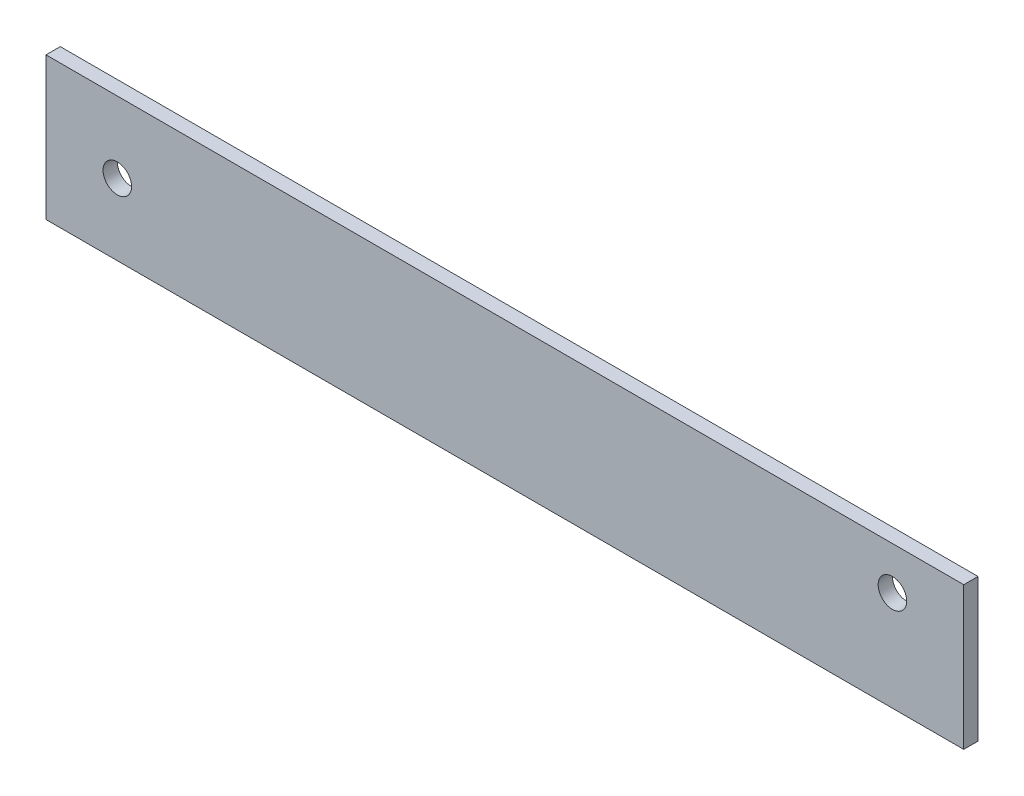
from build123d import *

# Parameters (mm, degrees)
ESQUISSE1_W      = 96.5
ESQUISSE1_H      = 15
ESQUISSE1_R      = 1.5
EXTRUSION1_DEPTH = 1.5


with BuildPart() as part:
    # Esquisse1 → Extrusion1 (new body)
    with BuildSketch(Plane.XY):
        with Locations((12.538961922, 4.173166844)):
            Rectangle(ESQUISSE1_W, ESQUISSE1_H)
        with Locations((-28.211038078, 4.173166844)):
            Circle(ESQUISSE1_R, mode=Mode.SUBTRACT)
        with Locations((53.288961922, 7.173166844)):
            Circle(ESQUISSE1_R, mode=Mode.SUBTRACT)
    extrude(amount=EXTRUSION1_DEPTH)


solid = part.part
